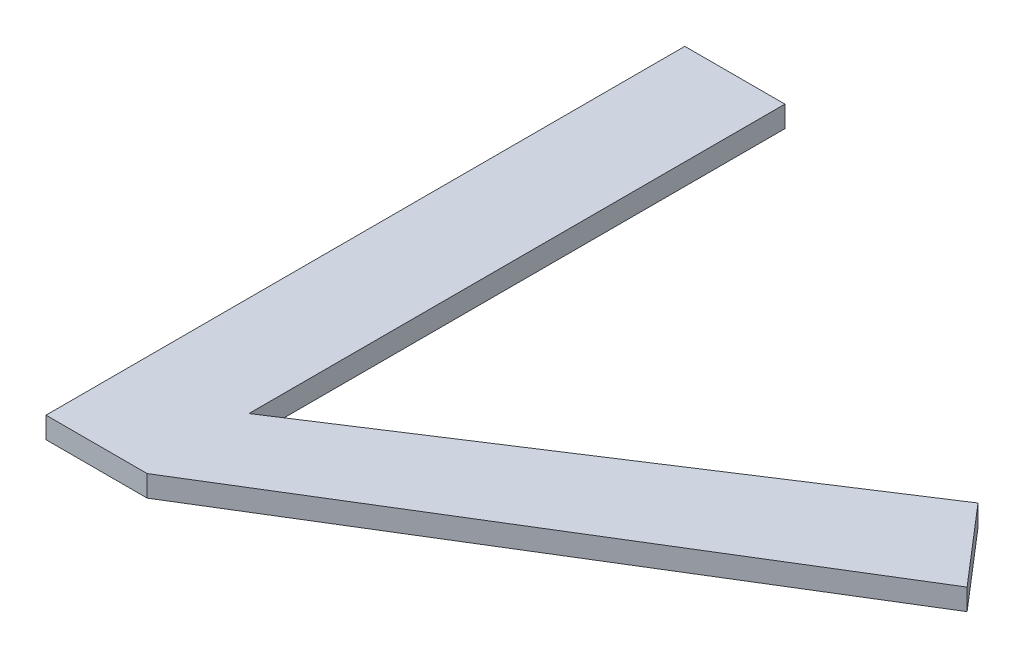
from build123d import *

# Parameters (mm, degrees)
BOSS_EXTRUDE1_DEPTH = 1


with BuildPart() as part:
    # Sketch1 → Boss-Extrude1 (new body)
    with BuildSketch(Plane(origin=(0, 0, 0), x_dir=(1, 0, 0), z_dir=(0, 1, 0))):
        Polygon((0, 0), (0, 25.168679903), (-4.7, 25.168679903), (-4.7, -4.831320097), (0.05, -4.831320097), (23.920795941, 9.803744), (20.757096557, 13.479816117), align=None)
    extrude(amount=BOSS_EXTRUDE1_DEPTH)


solid = part.part
